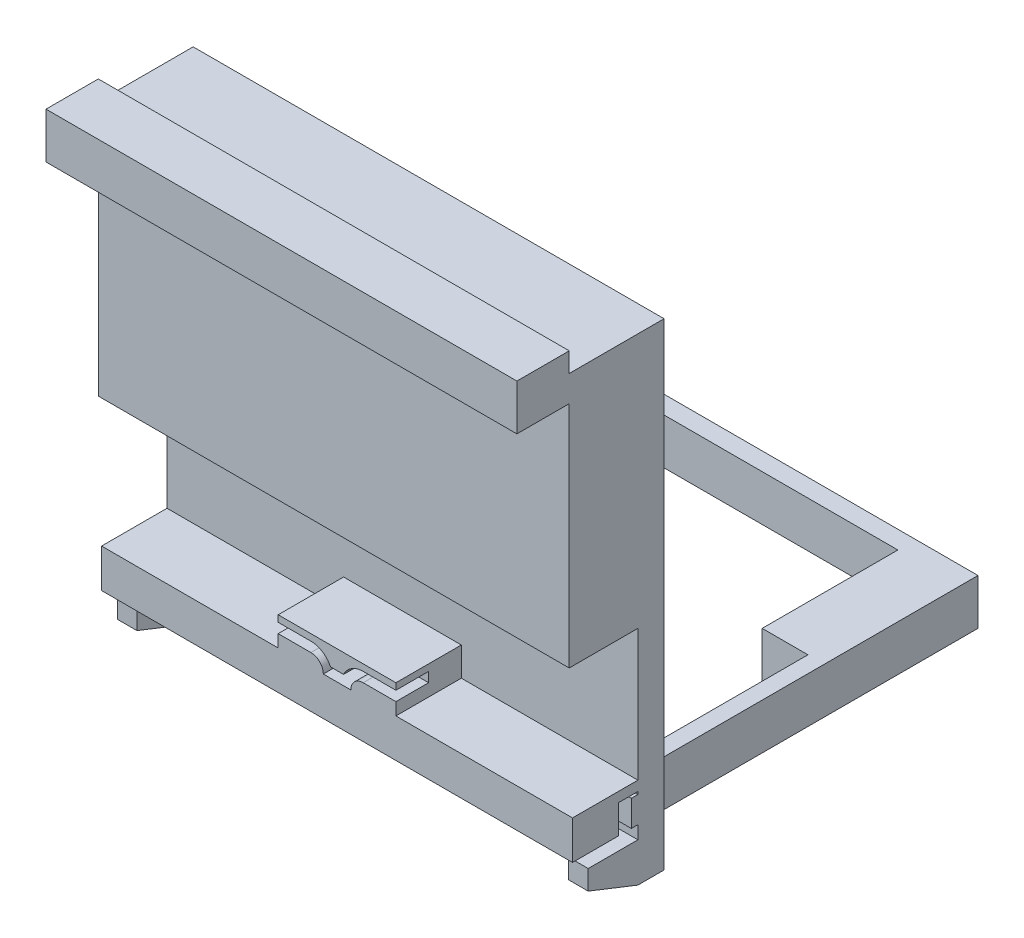
from build123d import *

# Parameters (mm, degrees)
CROQUIS1_W               = 72
CROQUIS1_H               = 74
SALIENTE_EXTRUIR3_DEPTH  = 4
CROQUIS2_W               = 3
CROQUIS2_H               = 6
SALIENTE_EXTRUIR4_DEPTH  = 7.6
CORTAR_EXTRUIR3_DEPTH    = 83.938591741
CROQUIS5_W               = 5
CROQUIS5_H               = 4
SALIENTE_EXTRUIR5_DEPTH  = 1
CROQUIS9_W               = 72
CROQUIS9_H               = 1.5
SALIENTE_EXTRUIR6_DEPTH  = 8
CROQUIS10_W              = 72
CROQUIS10_H              = 5.9
SALIENTE_EXTRUIR7_DEPTH  = 2
CROQUIS11_W              = 10
CROQUIS11_H              = 4.4
SALIENTE_EXTRUIR10_DEPTH = 7
SALIENTE_EXTRUIR14_DEPTH = 10
CROQUIS15_W              = 18
CROQUIS15_H              = 4.4
SALIENTE_EXTRUIR15_DEPTH = 5
CROQUIS16_W              = 72
CROQUIS16_H              = 40
SALIENTE_EXTRUIR16_DEPTH = 10.5
CROQUIS17_W              = 72
CROQUIS17_H              = 5
SALIENTE_EXTRUIR17_DEPTH = 8
CROQUIS18_W              = 72
CROQUIS18_H              = 8
SALIENTE_EXTRUIR19_DEPTH = 2
CROQUIS19_W              = 72
CROQUIS19_H              = 1
CORTAR_EXTRUIR4_DEPTH    = 14.5
CROQUIS20_W              = 56
CROQUIS20_H              = 7
SALIENTE_EXTRUIR20_DEPTH = 65
CORTAR_EXTRUIR6_REACH    = 103.4
CROQUIS27_W              = 56
CROQUIS27_H              = 9
CROQUIS26_R              = 1.25
CROQUIS26_R_2            = 1.3
CORTAR_EXTRUIR8_DEPTH    = 10


with BuildPart() as part:
    # Croquis1 → Saliente-Extruir3 (new body)
    with BuildSketch(Plane.XY):
        with Locations((0, -2.5)):
            Rectangle(CROQUIS1_W, CROQUIS1_H)
    extrude(amount=SALIENTE_EXTRUIR3_DEPTH)

    # Croquis2 → Saliente-Extruir4 (add)
    with BuildSketch(Plane.XY.offset(4)):
        with Locations((-34.5, -36.5)):
            Rectangle(CROQUIS2_W, CROQUIS2_H)
        with Locations((34.5, -36.5)):
            Rectangle(CROQUIS2_W, CROQUIS2_H)
    extrude(amount=SALIENTE_EXTRUIR4_DEPTH)

    # Croquis3 → Cortar-Extruir3 (cut, through all)
    with BuildSketch(Plane.ZY.offset(36)):
        Polygon((4, -39.5), (11.6, -36.5), (11.6, -39.5), align=None)
    extrude(amount=-CORTAR_EXTRUIR3_DEPTH, mode=Mode.SUBTRACT)

    # Croquis5 → Saliente-Extruir5 (add)
    with BuildSketch(Plane.XY.offset(4)):
        with Locations((-33.5, -30.5)):
            Rectangle(CROQUIS5_W, CROQUIS5_H)
        with Locations((33.5, -29.5)):
            Rectangle(CROQUIS5_W, CROQUIS5_H)
    extrude(amount=SALIENTE_EXTRUIR5_DEPTH)

    # Croquis9 → Saliente-Extruir6 (add)
    with BuildSketch(Plane.XY.offset(4)):
        with Locations((0, -26.35)):
            Rectangle(CROQUIS9_W, CROQUIS9_H)
    extrude(amount=SALIENTE_EXTRUIR6_DEPTH)

    # Croquis10 → Saliente-Extruir7 (add)
    with BuildSketch(Plane.XY.offset(12)):
        with Locations((0, -28.55)):
            Rectangle(CROQUIS10_W, CROQUIS10_H)
    extrude(amount=SALIENTE_EXTRUIR7_DEPTH)

    # Croquis11 → Saliente-Extruir10 (add)
    with BuildSketch(Plane.XY.offset(14)):
        with Locations((-31, -29.3)):
            Rectangle(CROQUIS11_W, CROQUIS11_H)
        with Locations((31, -29.3)):
            Rectangle(CROQUIS11_W, CROQUIS11_H)
    extrude(amount=-SALIENTE_EXTRUIR10_DEPTH)

    # Croquis14 → Saliente-Extruir14 (add)
    with BuildSketch(Plane.XY.offset(4)):
        with BuildLine():
            Line((-9, -23.7), (-9, -25.6))
            Line((-9, -25.6), (-2.1, -25.6))
            ThreePointArc((-2.1, -25.6), (-2.656497116, -24.256497116), (-4, -23.7))
            Line((-4, -23.7), (-9, -23.7))
        make_face()
        with BuildLine():
            Line((-9, -21.2), (-9, -22.2))
            Line((-9, -22.2), (-4, -22.2))
            ThreePointArc((-4, -22.2), (-2.22447191, -22.714955647), (-1, -24.1))
            Line((-1, -24.1), (1, -24.1))
            ThreePointArc((1, -24.1), (2.22447191, -22.714955647), (4, -22.2))
            Line((4, -22.2), (9, -22.2))
            Line((9, -22.2), (9, -21.2))
            Line((9, -21.2), (-9, -21.2))
        make_face()
        with BuildLine():
            ThreePointArc((4, -23.7), (2.656497116, -24.256497116), (2.1, -25.6))
            Line((2.1, -25.6), (9, -25.6))
            Line((9, -25.6), (9, -23.7))
            Line((9, -23.7), (4, -23.7))
        make_face()
    extrude(amount=SALIENTE_EXTRUIR14_DEPTH)

    # Croquis15 → Saliente-Extruir15 (add)
    with BuildSketch(Plane.XY.offset(4)):
        with Locations((0, -23.4)):
            Rectangle(CROQUIS15_W, CROQUIS15_H)
    extrude(amount=SALIENTE_EXTRUIR15_DEPTH)

    # Croquis16 → Saliente-Extruir16 (add)
    with BuildSketch(Plane.XY.offset(4)):
        with Locations((0, 14.5)):
            Rectangle(CROQUIS16_W, CROQUIS16_H)
    extrude(amount=SALIENTE_EXTRUIR16_DEPTH)

    # Croquis17 → Saliente-Extruir17 (add)
    with BuildSketch(Plane.XY.offset(14.5)):
        with Locations((0, 32)):
            Rectangle(CROQUIS17_W, CROQUIS17_H)
    extrude(amount=SALIENTE_EXTRUIR17_DEPTH)

    # Croquis18 → Saliente-Extruir19 (add)
    with BuildSketch(Plane(origin=(0, 34.5, 0), x_dir=(1, 0, 0), z_dir=(0, 1, 0))):
        with Locations((0, -18.5)):
            Rectangle(CROQUIS18_W, CROQUIS18_H)
    extrude(amount=SALIENTE_EXTRUIR19_DEPTH)

    # Croquis19 → Cortar-Extruir4 (cut)
    with BuildSketch(Plane(origin=(0, 0, 0), x_dir=(-1, 0, 0), z_dir=(0, 0, -1))):
        with Locations((0, 34)):
            Rectangle(CROQUIS19_W, CROQUIS19_H)
    extrude(amount=-CORTAR_EXTRUIR4_DEPTH, mode=Mode.SUBTRACT)

    # Croquis20 → Saliente-Extruir20 (add)
    with BuildSketch(Plane(origin=(0, 0, 0), x_dir=(-1, 0, 0), z_dir=(0, 0, -1))):
        with Locations((0, -36)):
            Rectangle(CROQUIS20_W, CROQUIS20_H)
    extrude(amount=SALIENTE_EXTRUIR20_DEPTH)

    # Croquis27 → Cortar-Extruir6 (cut, up to next)
    with BuildSketch(Plane(origin=(0, -32.5, 0), x_dir=(1, 0, 0), z_dir=(0, 1, 0)), mode=Mode.PRIVATE) as cortar_extruir6_sk1:
        with Locations((0, 60.5)):
            Rectangle(CROQUIS27_W, CROQUIS27_H)
    cortar_extruir6_tool1 = extrude(cortar_extruir6_sk1.sketch, amount=-CORTAR_EXTRUIR6_REACH, mode=Mode.PRIVATE) & part.part
    add(cortar_extruir6_tool1.solids().sort_by_distance((0, -32.5, -60.5))[0], mode=Mode.SUBTRACT)

    # Croquis26 → Cortar-Extruir8 (cut)
    with BuildSketch(Plane(origin=(0, -32.5, 0), x_dir=(1, 0, 0), z_dir=(0, 1, 0))):
        with Locations(Location((-18, 5, 0), (0, 0, 270))):
            Circle(CROQUIS26_R)
        with Locations(Location((18, 5, 0), (0, 0, 270))):
            Circle(CROQUIS26_R)
        with Locations(Location((-23, 43.25, 0), (0, 0, 270))):
            Circle(CROQUIS26_R)
        with Locations(Location((-24, 5, 0), (0, 0, 270))):
            Circle(CROQUIS26_R_2)
        Polygon((18.5, 53.25), (-20.5, 53.25), (-20.5, 33.25), (-10.5, 33.25), (-10.5, 7.5), (25.5, 7.5), (25.5, 32.5), (18.5, 32.5), align=None)
        with Locations(Location((24, 5, 0), (0, 0, 270))):
            Circle(CROQUIS26_R_2)
    extrude(amount=-CORTAR_EXTRUIR8_DEPTH, mode=Mode.SUBTRACT)


solid = part.part
